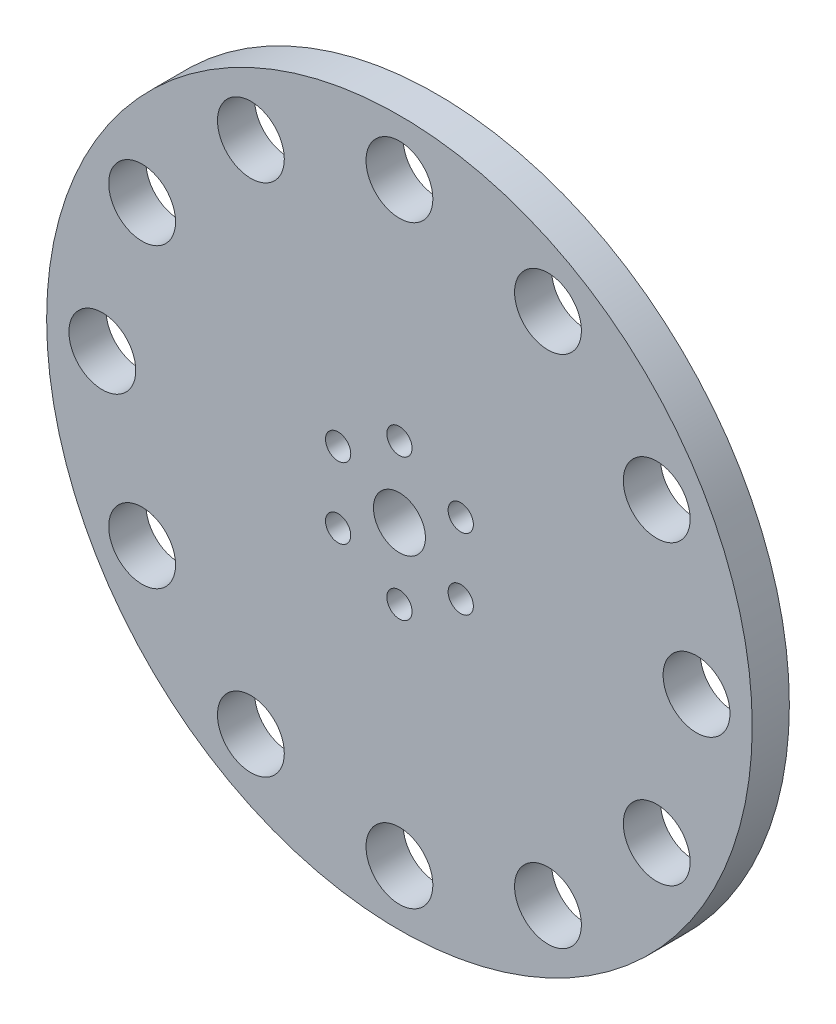
from build123d import *

# Parameters (mm, degrees)
SKETCH6_R           = 47.5
SKETCH6_R_2         = 3.5
BOSS_EXTRUDE1_DEPTH = 5
SKETCH7_R           = 1.7
SKETCH7_R_2         = 4.5
CUT_EXTRUDE3_DEPTH  = 5


with BuildPart() as part:
    # Sketch6 → Boss-Extrude1 (new body)
    with BuildSketch(Plane.XY):
        Circle(SKETCH6_R)
        Circle(SKETCH6_R_2, mode=Mode.SUBTRACT)
    extrude(amount=BOSS_EXTRUDE1_DEPTH)

    # Sketch7 → Cut-Extrude3 (cut)
    with BuildSketch(Plane.XY.offset(5)):
        with Locations((0, 9.53)):
            Circle(SKETCH7_R)
        with Locations((0, 40)):
            Circle(SKETCH7_R_2)
        with Locations((8.253222098, 4.765)):
            Circle(SKETCH7_R)
        with Locations((8.253222098, -4.765)):
            Circle(SKETCH7_R)
        with Locations((0, -9.53)):
            Circle(SKETCH7_R)
        with Locations((-8.253222098, -4.765)):
            Circle(SKETCH7_R)
        with Locations((-8.253222098, 4.765)):
            Circle(SKETCH7_R)
        with Locations((20, 34.641016151)):
            Circle(SKETCH7_R_2)
        with Locations((34.641016151, 20)):
            Circle(SKETCH7_R_2)
        with Locations((40, 0)):
            Circle(SKETCH7_R_2)
        with Locations((34.641016151, -20)):
            Circle(SKETCH7_R_2)
        with Locations((20, -34.641016151)):
            Circle(SKETCH7_R_2)
        with Locations((0, -40)):
            Circle(SKETCH7_R_2)
        with Locations((-20, -34.641016151)):
            Circle(SKETCH7_R_2)
        with Locations((-34.641016151, -20)):
            Circle(SKETCH7_R_2)
        with Locations((-40, 0)):
            Circle(SKETCH7_R_2)
        with Locations((-34.641016151, 20)):
            Circle(SKETCH7_R_2)
        with Locations((-20, 34.641016151)):
            Circle(SKETCH7_R_2)
    extrude(amount=-CUT_EXTRUDE3_DEPTH, mode=Mode.SUBTRACT)


solid = part.part
